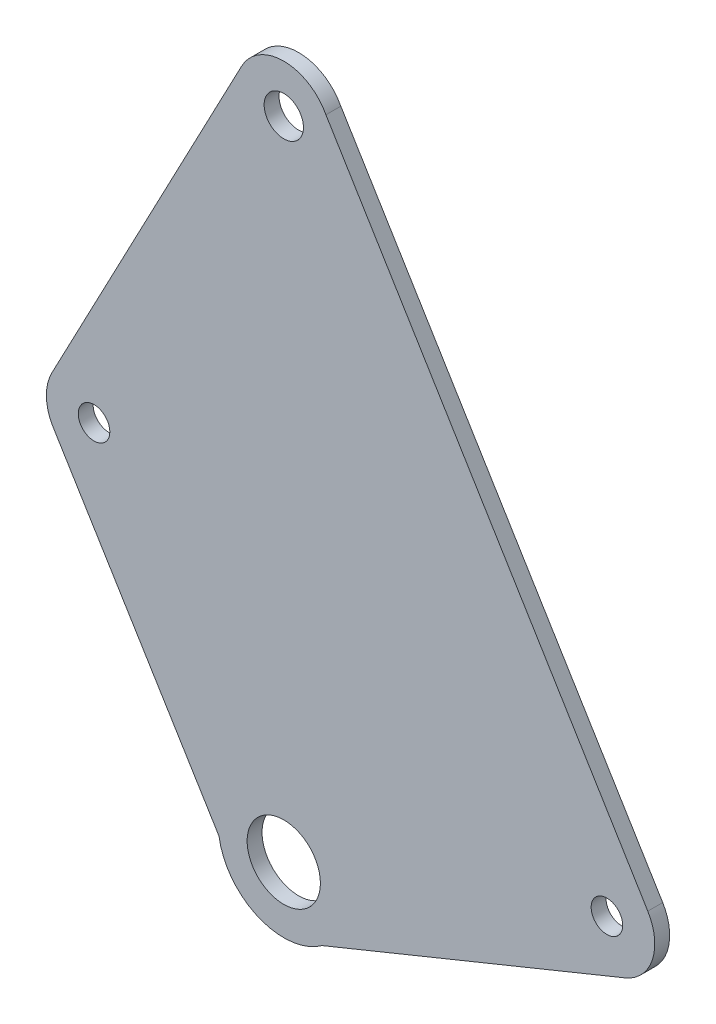
from build123d import *

# Parameters (mm, degrees)
SKETCH4_R           = 7.8105
SKETCH4_R_2         = 3.3655
SKETCH4_R_3         = 4.191
BOSS_EXTRUDE4_DEPTH = 3.175


with BuildPart() as part:
    # Sketch4 → Boss-Extrude4 (new body)
    with BuildSketch(Plane.XY):
        with BuildLine():
            Line((8.177790267, -11.326281223), (72.764042723, 15.002777148))
            ThreePointArc((72.764042723, 15.002777148), (78.603834041, 21.257958693), (77.62860989, 29.759687732))
            Line((77.62860989, 29.759687732), (8.990505701, 142.507164257))
            ThreePointArc((8.990505701, 142.507164257), (0, 147.93468), (-8.990505701, 142.507164257))
            Line((-8.990505701, 142.507164257), (-49.453246099, 65.638340515))
            ThreePointArc((-49.453246099, 65.638340515), (-50.622740399, 60.905856258), (-49.453246099, 56.173372001))
            Line((-49.453246099, 56.173372001), (-13.808489628, -2.118139324))
            ThreePointArc((-13.808489628, -2.118139324), (-5.396634426, -12.885543716), (8.177790267, -11.326281223))
        make_face()
        Circle(SKETCH4_R, mode=Mode.SUBTRACT)
        with Locations((-40.462740399, 60.905856258)):
            Circle(SKETCH4_R_2, mode=Mode.SUBTRACT)
        with Locations((68.911601974, 24.4529712)):
            Circle(SKETCH4_R_2, mode=Mode.SUBTRACT)
        with Locations((0, 137.77468)):
            Circle(SKETCH4_R_3, mode=Mode.SUBTRACT)
    extrude(amount=BOSS_EXTRUDE4_DEPTH)


solid = part.part
